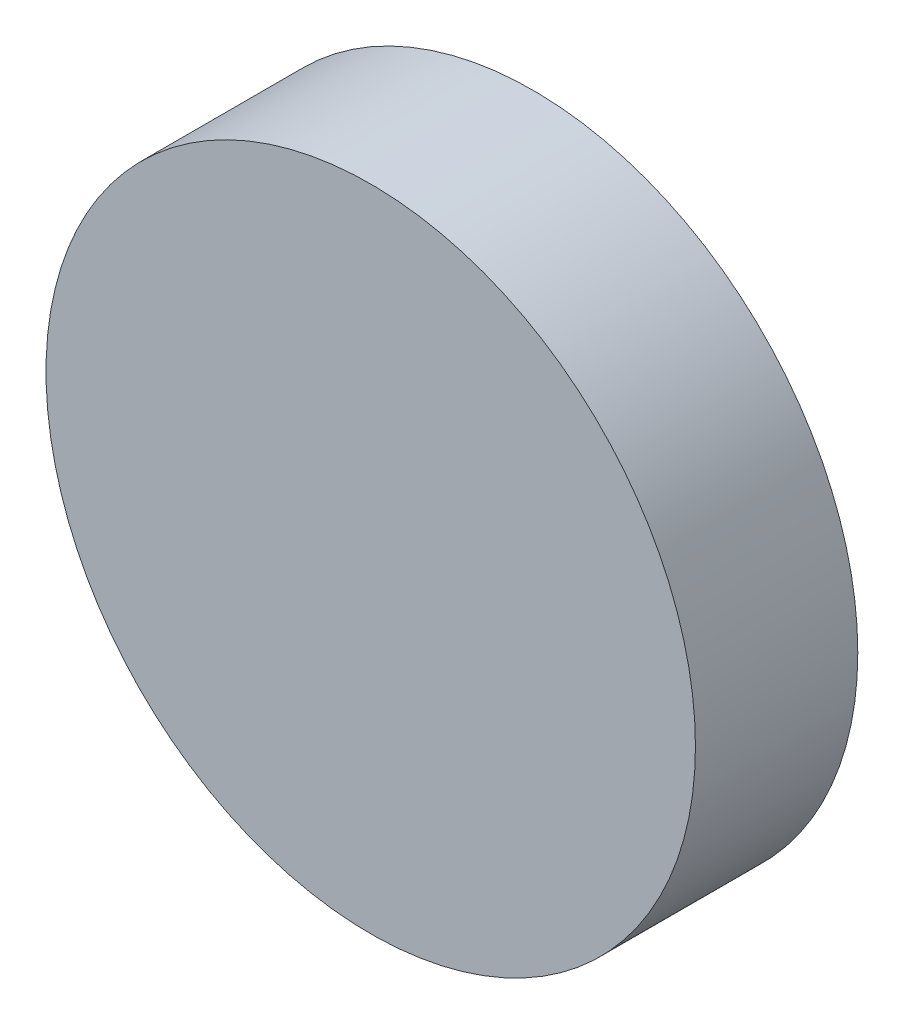
from build123d import *

# Parameters (mm, degrees)
SKETCH1_R           = 30
BOSS_EXTRUDE1_DEPTH = 15


with BuildPart() as part:
    # Sketch1 → Boss-Extrude1 (new body)
    with BuildSketch(Plane.XY):
        with Locations((66.5, -2.437272613)):
            Circle(SKETCH1_R)
    extrude(amount=BOSS_EXTRUDE1_DEPTH)


solid = part.part
